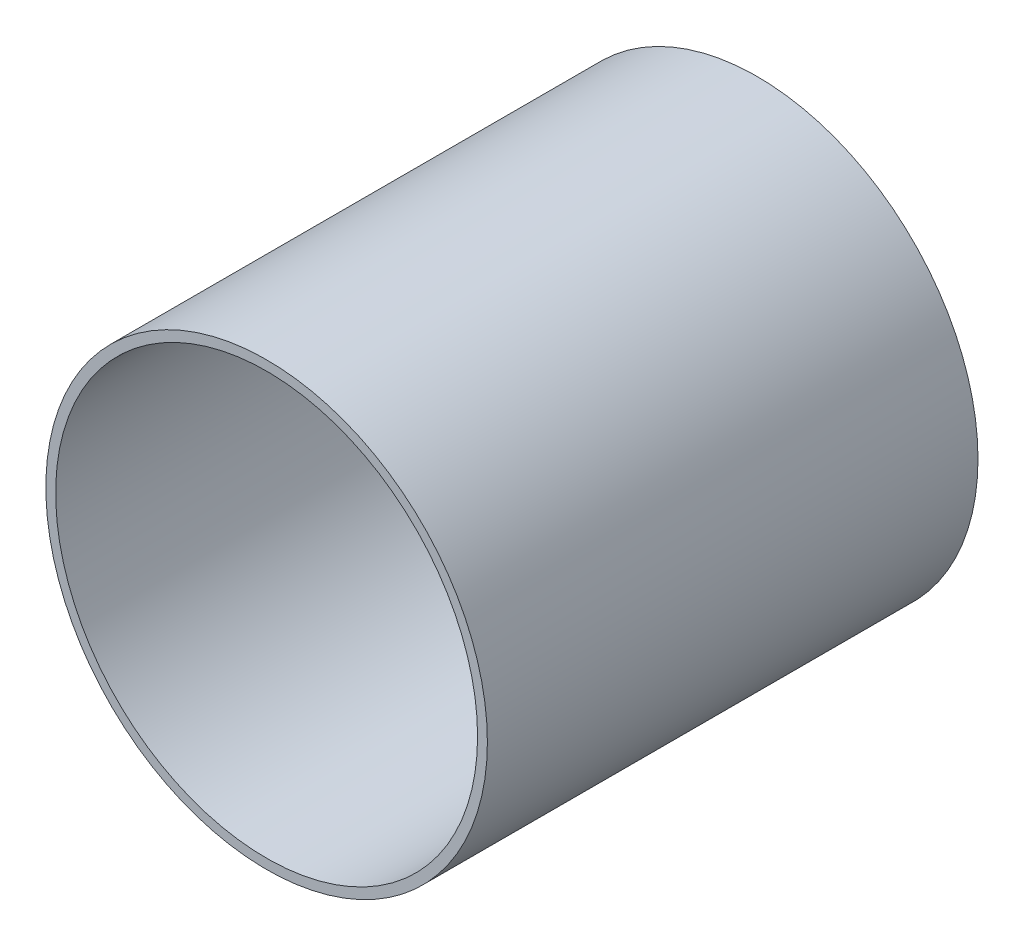
from build123d import *

# Parameters (mm, degrees)
SKETCH1_R           = 45
SKETCH1_R_2         = 43
BOSS_EXTRUDE1_DEPTH = 100


with BuildPart() as part:
    # Sketch1 → Boss-Extrude1 (new body)
    with BuildSketch(Plane.XY):
        Circle(SKETCH1_R)
        Circle(SKETCH1_R_2, mode=Mode.SUBTRACT)
    extrude(amount=BOSS_EXTRUDE1_DEPTH)


solid = part.part
